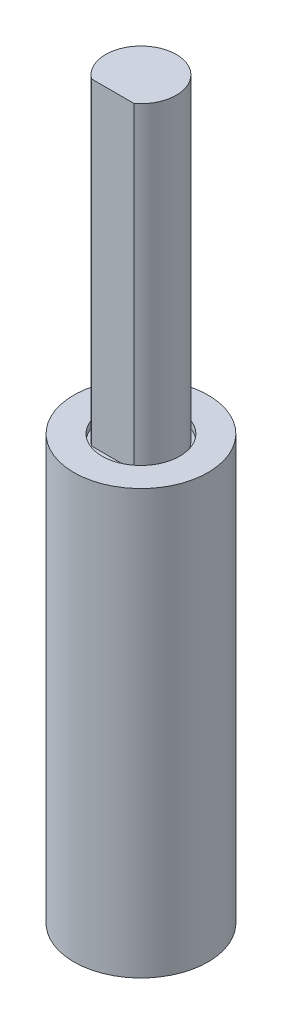
from build123d import *

# Parameters (mm, degrees)
SKETCH_1_R          = 4.75
EXTRUDE_1_DEPTH     = 30
SKETCH_2_R          = 2.75
CUT_EXTRUDE_1_DEPTH = 0.5
SKETCH_3_R          = 2.5
EXTRUDE_2_DEPTH     = 22.5
EXTRUDE_START       = 0.5
SKETCH_4_R          = 2.5
EXTRUDE_3_DEPTH     = 0.5
CUT_EXTRUDE_START   = -22.5
CUT_EXTRUDE_2_DEPTH = 22.5


with BuildPart() as part:
    # 草图1 → 凸台-拉伸1 (new body)
    with BuildSketch(Plane(origin=(0, 0, 0), x_dir=(1, 0, 0), z_dir=(0, 1, 0))):
        with Locations(Location((0, 0, 0), (0, 0, 270))):
            Circle(SKETCH_1_R)
    extrude(amount=EXTRUDE_1_DEPTH)

    # 草图2 → 切除-拉伸1 (cut)
    with BuildSketch(Plane(origin=(0, 30, 0), x_dir=(1, 0, 0), z_dir=(0, 1, 0))):
        with Locations(Location((0, 0, 0), (0, 0, 270))):
            Circle(SKETCH_2_R)
    extrude(amount=-CUT_EXTRUDE_1_DEPTH, mode=Mode.SUBTRACT)

    # 草图3 → 凸台-拉伸2 (add)
    with BuildSketch(Plane(origin=(0, 29.5, 0), x_dir=(1, 0, 0), z_dir=(0, 1, 0))):
        with Locations(Location((0, 0, 0), (0, 0, 90))):
            Circle(SKETCH_3_R)
    extrude(amount=EXTRUDE_2_DEPTH)

    # 草图4 → 凸台-拉伸3 (add)
    with BuildSketch(Plane.XZ.offset(EXTRUDE_START)):
        with Locations(Location((0, 0, 0), (0, 0, 270))):
            Circle(SKETCH_4_R)
    extrude(amount=-EXTRUDE_3_DEPTH)

    # 草图5 → 切除-拉伸2 (cut)
    with BuildSketch(Plane(origin=(0, 52, 0), x_dir=(1, 0, 0), z_dir=(0, 1, 0)).offset(CUT_EXTRUDE_START)):
        with BuildLine():
            Line((1.5, -2), (-1.5, -2))
            ThreePointArc((-1.5, -2), (0, -2.5), (1.5, -2))
        make_face()
    extrude(amount=CUT_EXTRUDE_2_DEPTH, mode=Mode.SUBTRACT)


solid = part.part
